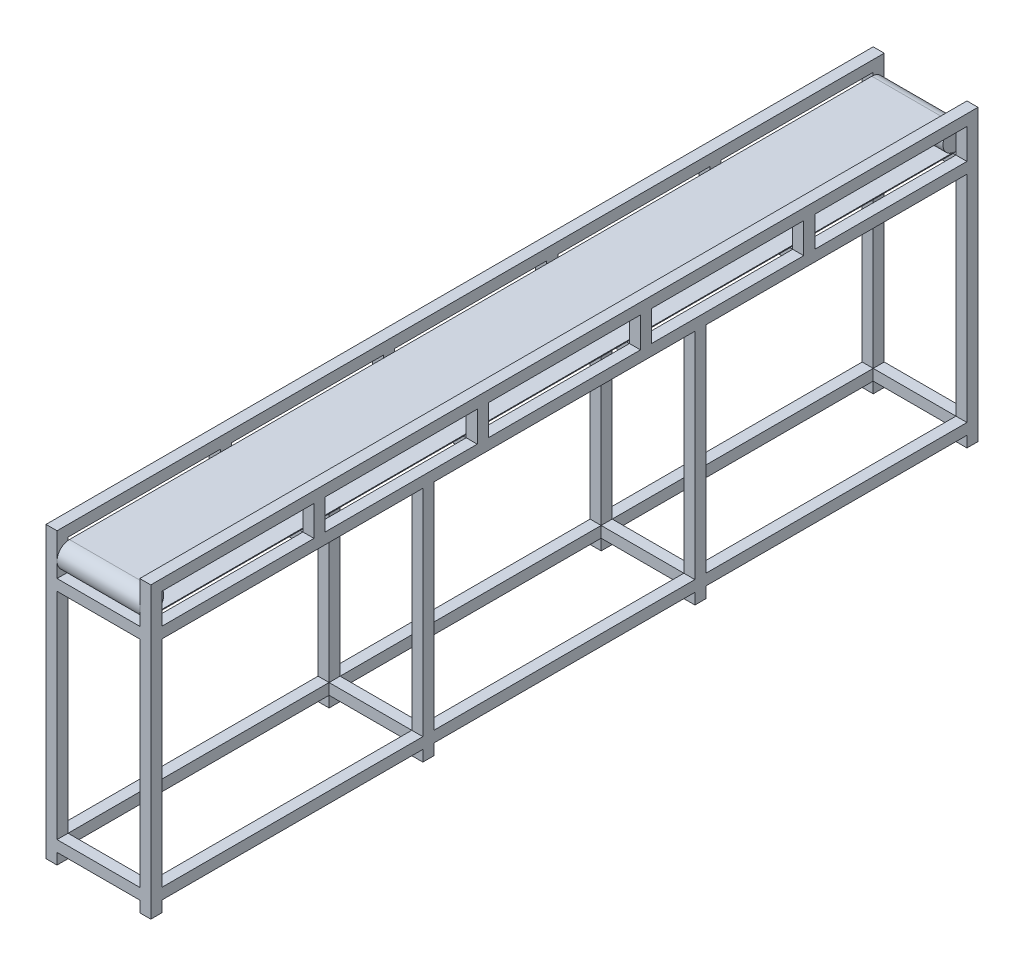
from build123d import *

# Parameters (mm, degrees)
SKIZZE1_W                            = 40
SKIZZE1_H                            = 860
SKIZZE1_H_2                          = 150
AUFSATZ_LINEAR_AUSTRAGEN1_DEPTH      = 3000
SCHNITT_LINEAR_AUSTRAGEN1_DEPTH      = 3202.077943443
SCHNITT_LINEAR_AUSTRAGEN1_DEPTH_BACK = 3202.077943443
SKIZZE2_W                            = 552
SKIZZE2_H                            = 110
SKIZZE2_W_2                          = 946.666666667
SKIZZE2_H_2                          = 780
SKIZZE2_W_3                          = 946.666666666
SKIZZE2_H_3                          = 40
SKIZZE3_W                            = 300
SKIZZE3_H                            = 552
SCHNITT_LINEAR_AUSTRAGEN2_DEPTH      = 3138.849582118
AUFSATZ_LINEAR_AUSTRAGEN2_DEPTH      = 300
SKIZZE5_W                            = 517
SKIZZE5_H                            = 5
SKIZZE5_W_2                          = 552
SKIZZE5_W_3                          = 40
AUFSATZ_LINEAR_AUSTRAGEN3_DEPTH      = 300
SKIZZE6_W                            = 40
SKIZZE6_H                            = 40
AUFSATZ_LINEAR_AUSTRAGEN4_DEPTH      = 300


with BuildPart() as part:
    # Skizze1 → Aufsatz-Linear austragen1 (new body)
    with BuildSketch(Plane.XY):
        with Locations((170, 430)):
            Rectangle(SKIZZE1_W, SKIZZE1_H)
        Polygon((-150, 900), (-190, 900), (-190, 860), (-150, 860), (150, 860), (190, 860), (190, 900), (150, 900), align=None)
        with Locations((170, 975)):
            Rectangle(SKIZZE1_W, SKIZZE1_H_2)
        with Locations((-170, 975)):
            Rectangle(SKIZZE1_W, SKIZZE1_H_2)
        with Locations((-170, 430)):
            Rectangle(SKIZZE1_W, SKIZZE1_H)
    extrude(amount=-AUFSATZ_LINEAR_AUSTRAGEN1_DEPTH)

    # Skizze2 → Schnitt-Linear austragen1 (cut, two sides: drawn at the far end of the back side and taken through both)
    with BuildSketch(Plane(origin=(190, 0, 0), x_dir=(0, 0, -1), z_dir=(1, 0, 0)).offset(-SCHNITT_LINEAR_AUSTRAGEN1_DEPTH_BACK)):
        with Locations((316, 955)):
            Rectangle(SKIZZE2_W, SKIZZE2_H)
        with Locations((908, 955)):
            Rectangle(SKIZZE2_W, SKIZZE2_H)
        with Locations((513.333333334, 470)):
            Rectangle(SKIZZE2_W_2, SKIZZE2_H_2)
        with Locations((1500, 470)):
            Rectangle(SKIZZE2_W_3, SKIZZE2_H_2)
        with Locations((2486.666666667, 470)):
            Rectangle(SKIZZE2_W_2, SKIZZE2_H_2)
        with Locations((513.333333334, 20)):
            Rectangle(SKIZZE2_W_2, SKIZZE2_H_3)
        with Locations((1500, 20)):
            Rectangle(SKIZZE2_W_3, SKIZZE2_H_3)
        with Locations((2486.666666667, 20)):
            Rectangle(SKIZZE2_W_2, SKIZZE2_H_3)
        with Locations((1500, 955)):
            Rectangle(SKIZZE2_W, SKIZZE2_H)
        with Locations((2092, 955)):
            Rectangle(SKIZZE2_W, SKIZZE2_H)
        with Locations((2684, 955)):
            Rectangle(SKIZZE2_W, SKIZZE2_H)
    extrude(amount=SCHNITT_LINEAR_AUSTRAGEN1_DEPTH + SCHNITT_LINEAR_AUSTRAGEN1_DEPTH_BACK, mode=Mode.SUBTRACT)

    # Skizze3 → Schnitt-Linear austragen2 (cut, through all)
    with BuildSketch(Plane(origin=(0, 900, 0), x_dir=(1, 0, 0), z_dir=(0, 1, 0))):
        with Locations((0, 2684)):
            Rectangle(SKIZZE3_W, SKIZZE3_H)
        with Locations((0, 2092)):
            Rectangle(SKIZZE3_W, SKIZZE3_H)
        with Locations((0, 1500)):
            Rectangle(SKIZZE3_W, SKIZZE3_H)
        with Locations((0, 908)):
            Rectangle(SKIZZE3_W, SKIZZE3_H)
        with Locations((0, 316)):
            Rectangle(SKIZZE3_W, SKIZZE3_H)
    extrude(amount=-SCHNITT_LINEAR_AUSTRAGEN2_DEPTH, mode=Mode.SUBTRACT)

    # Skizze5 → Aufsatz-Linear austragen3 (add)
    with BuildSketch(Plane.ZY.offset(-150)):
        with Locations((-2666.5, 994.5)):
            Rectangle(SKIZZE5_W, SKIZZE5_H)
        with BuildLine():
            ThreePointArc((-2960, 913.298681076), (-2927.12528027, 923.583443855), (-2913, 955))
            ThreePointArc((-2913, 955), (-2927.12528027, 986.416556145), (-2960, 996.701318924))
            Line((-2960, 996.701318924), (-2960, 913.298681076))
        make_face()
        with BuildLine():
            Line((-2960, 913.298681076), (-2960, 996.701318924))
            ThreePointArc((-2960, 996.701318924), (-2997, 955), (-2960, 913.298681076))
        make_face()
        with Locations((-2092, 994.5)):
            Rectangle(SKIZZE5_W_2, SKIZZE5_H)
        with Locations((-2388, 994.5)):
            Rectangle(SKIZZE5_W_3, SKIZZE5_H)
        with Locations((-1500, 994.5)):
            Rectangle(SKIZZE5_W_2, SKIZZE5_H)
        with Locations((-1796, 994.5)):
            Rectangle(SKIZZE5_W_3, SKIZZE5_H)
        with Locations((-908, 994.5)):
            Rectangle(SKIZZE5_W_2, SKIZZE5_H)
        with Locations((-1204, 994.5)):
            Rectangle(SKIZZE5_W_3, SKIZZE5_H)
        with Locations((-612, 994.5)):
            Rectangle(SKIZZE5_W_3, SKIZZE5_H)
        with BuildLine():
            ThreePointArc((-40, 913.298681076), (-13.583443855, 927.12528027), (-3, 955))
            ThreePointArc((-3, 955), (-13.583443855, 982.87471973), (-40, 996.701318924))
            Line((-40, 996.701318924), (-40, 913.298681076))
        make_face()
        with BuildLine():
            Line((-40, 913.298681076), (-40, 996.701318924))
            ThreePointArc((-40, 996.701318924), (-87, 955), (-40, 913.298681076))
        make_face()
        with Locations((-333.5, 994.5)):
            Rectangle(SKIZZE5_W, SKIZZE5_H)
    extrude(amount=AUFSATZ_LINEAR_AUSTRAGEN3_DEPTH)

    # Skizze6 → Aufsatz-Linear austragen4 (add)
    with BuildSketch(Plane.ZY.offset(-150)):
        with Locations((-2980, 60)):
            Rectangle(SKIZZE6_W, SKIZZE6_H)
        with Locations((-1993.333333333, 60)):
            Rectangle(SKIZZE6_W, SKIZZE6_H)
        with Locations((-20, 60)):
            Rectangle(SKIZZE6_W, SKIZZE6_H)
        with Locations((-1006.666666667, 60)):
            Rectangle(SKIZZE6_W, SKIZZE6_H)
    extrude(amount=AUFSATZ_LINEAR_AUSTRAGEN4_DEPTH)


with BuildPart() as body_2:
    # Skizze4 → Aufsatz-Linear austragen2 (new body)
    with BuildSketch(Plane.ZY.offset(-150)):
        with BuildLine():
            Line((-2955, 1000), (-45, 1000))
            ThreePointArc((-45, 1000), (0, 955), (-45, 910))
            Line((-45, 910), (-2955, 910))
            ThreePointArc((-2955, 910), (-3000, 955), (-2955, 1000))
        make_face()
        with BuildLine():
            Line((-2955, 997), (-45, 997))
            ThreePointArc((-45, 997), (-3, 955), (-45, 913))
            Line((-45, 913), (-2955, 913))
            ThreePointArc((-2955, 913), (-2997, 955), (-2955, 997))
        make_face(mode=Mode.SUBTRACT)
    extrude(amount=AUFSATZ_LINEAR_AUSTRAGEN2_DEPTH)


solid = Compound([part.part, body_2.part])
